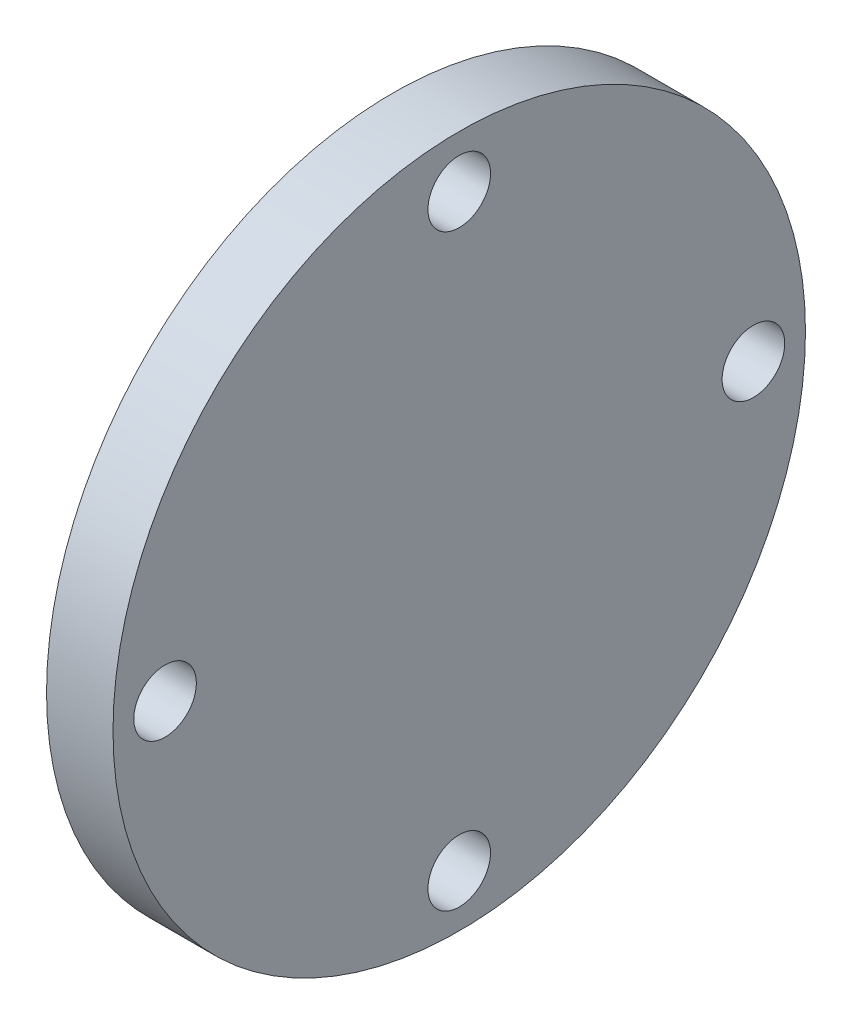
from build123d import *

# Parameters (mm, degrees)
SKETCH2_R          = 1.4351
CUT_EXTRUDE1_DEPTH = 24.075588963


with BuildPart() as part:
    # Sketch1 → Revolve1 (revolve)
    with BuildSketch(Plane.XY, mode=Mode.PRIVATE) as revolve1_sk:
        Polygon((0, 0), (0, 15.875), (-3.048, 15.875), (-3.048, 11.1125), (-5.334, 11.1125), (-5.334, 0), align=None)
    revolve(revolve1_sk.sketch.rotate(Axis((0, 0, 0), (-1, 0, 0)), 90), axis=Axis((0, 0, 0), (-1, 0, 0)))

    # Sketch2 → Cut-Extrude1 (cut, through all)
    with BuildSketch(Plane(origin=(0, 0, 0), x_dir=(0, 0, -1), z_dir=(1, 0, 0))):
        with Locations((0, 13.4874)):
            Circle(SKETCH2_R)
        with Locations((13.4874, 0)):
            Circle(SKETCH2_R)
        with Locations((0, -13.4874)):
            Circle(SKETCH2_R)
        with Locations((-13.4874, 0)):
            Circle(SKETCH2_R)
    extrude(amount=-CUT_EXTRUDE1_DEPTH, mode=Mode.SUBTRACT)


solid = part.part
